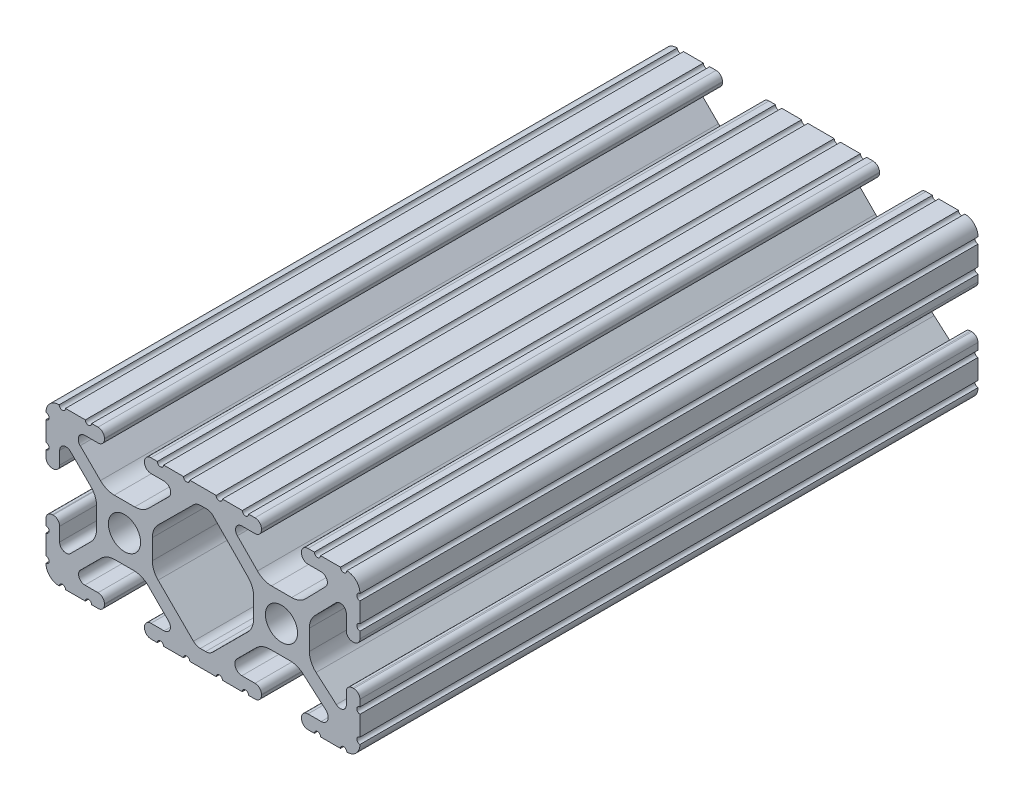
from build123d import *

# Parameters (mm, degrees)
SKETCH1_R           = 2.6035
BOSS_EXTRUDE1_DEPTH = 50


with BuildPart() as part:
    # Sketch1 → Boss-Extrude1 (new, symmetric)
    with BuildSketch(Plane.XY):
        with BuildLine():
            Line((18.01710265, 12.7), (16.98745015, 12.7))
            ThreePointArc((16.98745015, 12.7), (16.245730386, 12.392769614), (15.9385, 11.65104985))
            Line((15.9385, 11.65104985), (15.9385, 11.53922))
            ThreePointArc((15.9385, 11.53922), (16.245750844, 10.797450844), (16.98752, 10.4902))
            Line((16.98752, 10.4902), (19.116384363, 10.4902))
            ThreePointArc((19.116384363, 10.4902), (20.052502933, 9.869096983), (19.844087081, 8.765172272))
            Line((19.844087081, 8.765172272), (16.618993479, 5.455112286))
            ThreePointArc((16.618993479, 5.455112286), (15.578994274, 4.745442459), (14.344932584, 4.4958))
            Line((14.344932584, 4.4958), (11.083317835, 4.4958))
            ThreePointArc((11.083317835, 4.4958), (9.854330953, 4.743306833), (8.816955189, 5.447238587))
            Line((8.816955189, 5.447238587), (5.564154119, 8.762652677))
            ThreePointArc((5.564154119, 8.762652677), (5.352591412, 9.867473037), (6.289393385, 10.4902))
            Line((6.289393385, 10.4902), (8.41248, 10.4902))
            ThreePointArc((8.41248, 10.4902), (9.154249156, 10.797450844), (9.4615, 11.53922))
            Line((9.4615, 11.53922), (9.4615, 11.65104985))
            ThreePointArc((9.4615, 11.65104985), (9.154269614, 12.392769614), (8.41254985, 12.7))
            Line((8.41254985, 12.7), (7.38288465, 12.7))
            ThreePointArc((7.38288465, 12.7), (6.87488465, 12.192), (6.36688465, 12.7))
            Line((6.36688465, 12.7), (3.14958095, 12.7))
            ThreePointArc((3.14958095, 12.7), (2.64158095, 12.192), (2.13358095, 12.7))
            Line((2.13358095, 12.7), (-2.13358095, 12.7))
            ThreePointArc((-2.13358095, 12.7), (-2.64158095, 12.192), (-3.14958095, 12.7))
            Line((-3.14958095, 12.7), (-6.36689735, 12.7))
            ThreePointArc((-6.36689735, 12.7), (-6.87489735, 12.192), (-7.38289735, 12.7))
            Line((-7.38289735, 12.7), (-8.41254985, 12.7))
            ThreePointArc((-8.41254985, 12.7), (-9.154269614, 12.392769614), (-9.4615, 11.65104985))
            Line((-9.4615, 11.65104985), (-9.4615, 11.53922))
            ThreePointArc((-9.4615, 11.53922), (-9.154249156, 10.797450844), (-8.41248, 10.4902))
            Line((-8.41248, 10.4902), (-6.283641037, 10.4902))
            ThreePointArc((-6.283641037, 10.4902), (-5.297291557, 9.829633109), (-5.532576693, 8.666071843))
            Line((-5.532576693, 8.666071843), (-8.809985098, 5.416263103))
            ThreePointArc((-8.809985098, 5.416263103), (-9.836720513, 4.734920264), (-11.045536121, 4.4958))
            Line((-11.045536121, 4.4958), (-14.354463879, 4.4958))
            ThreePointArc((-14.354463879, 4.4958), (-15.563279487, 4.734920264), (-16.590014902, 5.416263103))
            Line((-16.590014902, 5.416263103), (-19.867423307, 8.666071843))
            ThreePointArc((-19.867423307, 8.666071843), (-20.102708443, 9.829633109), (-19.116358963, 10.4902))
            Line((-19.116358963, 10.4902), (-16.98752, 10.4902))
            ThreePointArc((-16.98752, 10.4902), (-16.245750844, 10.797450844), (-15.9385, 11.53922))
            Line((-15.9385, 11.53922), (-15.9385, 11.65104985))
            ThreePointArc((-15.9385, 11.65104985), (-16.245730386, 12.392769614), (-16.98745015, 12.7))
            Line((-16.98745015, 12.7), (-18.01711535, 12.7))
            ThreePointArc((-18.01711535, 12.7), (-18.52511535, 12.192), (-19.03311535, 12.7))
            Line((-19.03311535, 12.7), (-22.2504, 12.7))
            ThreePointArc((-22.2504, 12.7), (-22.758323491, 12.192000006), (-23.266399977, 12.699846982))
            ThreePointArc((-23.266399977, 12.699846982), (-24.782522516, 12.082522516), (-25.399846982, 10.566399977))
            ThreePointArc((-25.399846982, 10.566399977), (-24.892000006, 10.058323491), (-25.4, 9.5504))
            Line((-25.4, 9.5504), (-25.4, 6.3330836))
            ThreePointArc((-25.4, 6.3330836), (-24.892, 5.8250836), (-25.4, 5.3170836))
            Line((-25.4, 5.3170836), (-25.4, 4.237520184))
            ThreePointArc((-25.4, 4.237520184), (-25.107393763, 3.531106237), (-24.400979816, 3.2385))
            Line((-24.400979816, 3.2385), (-24.23922, 3.2385))
            ThreePointArc((-24.23922, 3.2385), (-23.497450844, 3.545750844), (-23.1902, 4.28752))
            Line((-23.1902, 4.28752), (-23.1902, 6.334741132))
            ThreePointArc((-23.1902, 6.334741132), (-22.556026952, 7.286023527), (-21.434002553, 7.066535717))
            Line((-21.434002553, 7.066535717), (-18.147950853, 3.808156468))
            ThreePointArc((-18.147950853, 3.808156468), (-17.452759693, 2.774838327), (-17.208501877, 1.553619571))
            Line((-17.208501877, 1.553619571), (-17.208501877, -1.695179196))
            ThreePointArc((-17.208501877, -1.695179196), (-17.450738657, -2.911536421), (-18.140486065, -3.942289578))
            Line((-18.140486065, -3.942289578), (-21.431579576, -7.227386226))
            ThreePointArc((-21.431579576, -7.227386226), (-22.55444896, -7.449940594), (-23.1902, -6.498002195))
            Line((-23.1902, -6.498002195), (-23.1902, -4.28752))
            ThreePointArc((-23.1902, -4.28752), (-23.497450844, -3.545750844), (-24.23922, -3.2385))
            Line((-24.23922, -3.2385), (-24.35098, -3.2385))
            ThreePointArc((-24.35098, -3.2385), (-25.092749156, -3.545750844), (-25.4, -4.28752))
            Line((-25.4, -4.28752), (-25.4, -5.3171344))
            ThreePointArc((-25.4, -5.3171344), (-24.892, -5.8251344), (-25.4, -6.3331344))
            Line((-25.4, -6.3331344), (-25.4, -9.5504))
            ThreePointArc((-25.4, -9.5504), (-24.892000006, -10.058323491), (-25.399846982, -10.566399977))
            ThreePointArc((-25.399846982, -10.566399977), (-24.782522516, -12.082522516), (-23.266399977, -12.699846982))
            ThreePointArc((-23.266399977, -12.699846982), (-22.758323491, -12.192000006), (-22.2504, -12.7))
            Line((-22.2504, -12.7), (-19.03308995, -12.7))
            ThreePointArc((-19.03308995, -12.7), (-18.52508995, -12.192), (-18.01708995, -12.7))
            Line((-18.01708995, -12.7), (-16.9874692, -12.7))
            ThreePointArc((-16.9874692, -12.7), (-16.245700044, -12.392749156), (-15.9384492, -11.65098))
            Line((-15.9384492, -11.65098), (-15.9384492, -11.53922))
            ThreePointArc((-15.9384492, -11.53922), (-16.245700044, -10.797450844), (-16.9874692, -10.4902))
            Line((-16.9874692, -10.4902), (-19.116358963, -10.4902))
            ThreePointArc((-19.116358963, -10.4902), (-20.055197748, -9.862578342), (-19.834124023, -8.755124678))
            Line((-19.834124023, -8.755124678), (-16.49660751, -5.423689618))
            ThreePointArc((-16.49660751, -5.423689618), (-15.467274017, -4.736928798), (-14.253591699, -4.4958))
            Line((-14.253591699, -4.4958), (-11.146408301, -4.4958))
            ThreePointArc((-11.146408301, -4.4958), (-9.932725983, -4.736928798), (-8.90339249, -5.423689618))
            Line((-8.90339249, -5.423689618), (-5.565875977, -8.755124678))
            ThreePointArc((-5.565875977, -8.755124678), (-5.344802252, -9.862578342), (-6.283641037, -10.4902))
            Line((-6.283641037, -10.4902), (-8.4125308, -10.4902))
            ThreePointArc((-8.4125308, -10.4902), (-9.154299956, -10.797450844), (-9.4615508, -11.53922))
            Line((-9.4615508, -11.53922), (-9.4615508, -11.65098))
            ThreePointArc((-9.4615508, -11.65098), (-9.154299956, -12.392749156), (-8.4125308, -12.7))
            Line((-8.4125308, -12.7), (-7.38287195, -12.7))
            ThreePointArc((-7.38287195, -12.7), (-6.87487195, -12.192), (-6.36687195, -12.7))
            Line((-6.36687195, -12.7), (-3.14960635, -12.7))
            ThreePointArc((-3.14960635, -12.7), (-2.64160635, -12.192), (-2.13360635, -12.7))
            Line((-2.13360635, -12.7), (2.13360635, -12.7))
            ThreePointArc((2.13360635, -12.7), (2.64159365, -12.1920127), (3.14958095, -12.7))
            Line((3.14958095, -12.7), (6.36691005, -12.7))
            ThreePointArc((6.36691005, -12.7), (6.87491005, -12.192), (7.38291005, -12.7))
            Line((7.38291005, -12.7), (8.4125308, -12.7))
            ThreePointArc((8.4125308, -12.7), (9.154299956, -12.392749156), (9.4615508, -11.65098))
            Line((9.4615508, -11.65098), (9.4615508, -11.53922))
            ThreePointArc((9.4615508, -11.53922), (9.154299956, -10.797450844), (8.4125308, -10.4902))
            Line((8.4125308, -10.4902), (6.289393385, -10.4902))
            ThreePointArc((6.289393385, -10.4902), (5.231590322, -9.783049717), (5.480677245, -8.535265862))
            Line((5.480677245, -8.535265862), (8.597933595, -5.423689618))
            ThreePointArc((8.597933595, -5.423689618), (9.627267088, -4.736928798), (10.840949406, -4.4958))
            Line((10.840949406, -4.4958), (14.102564155, -4.4958))
            ThreePointArc((14.102564155, -4.4958), (15.215927525, -4.697410182), (16.187895372, -5.276636531))
            Line((16.187895372, -5.276636531), (19.868247549, -8.482246082))
            ThreePointArc((19.868247549, -8.482246082), (20.188435806, -9.746879864), (19.116384363, -10.4902))
            Line((19.116384363, -10.4902), (16.9874692, -10.4902))
            ThreePointArc((16.9874692, -10.4902), (16.245700044, -10.797450844), (15.9384492, -11.53922))
            Line((15.9384492, -11.53922), (15.9384492, -11.65098))
            ThreePointArc((15.9384492, -11.65098), (16.245700044, -12.392749156), (16.9874692, -12.7))
            Line((16.9874692, -12.7), (18.01710265, -12.7))
            ThreePointArc((18.01710265, -12.7), (18.52510265, -12.192), (19.03310265, -12.7))
            Line((19.03310265, -12.7), (22.2504, -12.7))
            ThreePointArc((22.2504, -12.7), (22.758323491, -12.192000006), (23.266399977, -12.699846982))
            ThreePointArc((23.266399977, -12.699846982), (24.782522516, -12.082522516), (25.399846982, -10.566399977))
            ThreePointArc((25.399846982, -10.566399977), (24.892000006, -10.058323492), (25.4, -9.550400001))
            Line((25.4, -9.550400001), (25.4, -6.333083592))
            ThreePointArc((25.4, -6.333083592), (24.892000001, -5.825083593), (25.4, -5.317083593))
            Line((25.4, -5.317083593), (25.4, -4.237520184))
            ThreePointArc((25.4, -4.237520184), (25.107393763, -3.531106237), (24.400979816, -3.2385))
            Line((24.400979816, -3.2385), (24.189220184, -3.2385))
            ThreePointArc((24.189220184, -3.2385), (23.482806237, -3.531106237), (23.1902, -4.237520184))
            Line((23.1902, -4.237520184), (23.1902, -6.155876159))
            ThreePointArc((23.1902, -6.155876159), (22.62232736, -7.038258539), (21.583974541, -6.886926384))
            Line((21.583974541, -6.886926384), (18.29817066, -4.024970844))
            ThreePointArc((18.29817066, -4.024970844), (17.493730985, -2.946044689), (17.208501877, -1.630807374))
            Line((17.208501877, -1.630807374), (17.208501877, 1.630807374))
            ThreePointArc((17.208501877, 1.630807374), (17.442348332, 2.82673414), (18.109440981, 3.846495088))
            Line((18.109440981, 3.846495088), (21.526346532, 7.353420386))
            ThreePointArc((21.526346532, 7.353420386), (22.585896263, 7.574939077), (23.1902, 6.676867167))
            Line((23.1902, 6.676867167), (23.1902, 4.237520184))
            ThreePointArc((23.1902, 4.237520184), (23.482806237, 3.531106237), (24.189220184, 3.2385))
            Line((24.189220184, 3.2385), (24.400979816, 3.2385))
            ThreePointArc((24.400979816, 3.2385), (25.107393763, 3.531106237), (25.4, 4.237520184))
            Line((25.4, 4.237520184), (25.4, 5.3170836))
            ThreePointArc((25.4, 5.3170836), (24.891949193, 5.825134407), (25.4, 6.333185215))
            Line((25.4, 6.333185215), (25.4, 9.550400015))
            ThreePointArc((25.4, 9.550400015), (24.892000013, 10.058323498), (25.399846982, 10.566399977))
            ThreePointArc((25.399846982, 10.566399977), (24.782522516, 12.082522516), (23.266399977, 12.699846982))
            ThreePointArc((23.266399977, 12.699846982), (22.758323491, 12.192000006), (22.2504, 12.7))
            Line((22.2504, 12.7), (19.03310265, 12.7))
            ThreePointArc((19.03310265, 12.7), (18.52510265, 12.192), (18.01710265, 12.7))
        make_face()
        with Locations((-12.7, 0)):
            Circle(SKETCH1_R, mode=Mode.SUBTRACT)
        with Locations((12.7, 0)):
            Circle(SKETCH1_R, mode=Mode.SUBTRACT)
        with BuildLine():
            Line((-7.259513935, -3.869413038), (-1.545748891, -9.572766749))
            ThreePointArc((-1.545748891, -9.572766749), (-1.035199478, -9.913400116), (-0.433213048, -10.033))
            Line((-0.433213048, -10.033), (0.433213048, -10.033))
            ThreePointArc((0.433213048, -10.033), (1.035199478, -9.913400116), (1.545748891, -9.572766749))
            Line((1.545748891, -9.572766749), (7.259513935, -3.869413038))
            ThreePointArc((7.259513935, -3.869413038), (7.949261343, -2.838659881), (8.191498123, -1.622302656))
            Line((8.191498123, -1.622302656), (8.191498123, 1.622302656))
            ThreePointArc((8.191498123, 1.622302656), (7.955573352, 2.823327967), (7.282860769, 3.845864069))
            Line((7.282860769, 3.845864069), (1.675572808, 9.561086461))
            ThreePointArc((1.675572808, 9.561086461), (1.161034429, 9.910236611), (0.551456936, 10.033))
            Line((0.551456936, 10.033), (-0.395199982, 10.033))
            ThreePointArc((-0.395199982, 10.033), (-0.994772524, 9.914396349), (-1.50403329, 9.576450301))
            Line((-1.50403329, 9.576450301), (-7.252049147, 3.876839553))
            ThreePointArc((-7.252049147, 3.876839553), (-7.947240307, 2.843521412), (-8.191498123, 1.622302656))
            Line((-8.191498123, 1.622302656), (-8.191498123, -1.622302656))
            ThreePointArc((-8.191498123, -1.622302656), (-7.949261343, -2.838659881), (-7.259513935, -3.869413038))
        make_face(mode=Mode.SUBTRACT)
    extrude(amount=BOSS_EXTRUDE1_DEPTH, both=True)


solid = part.part
